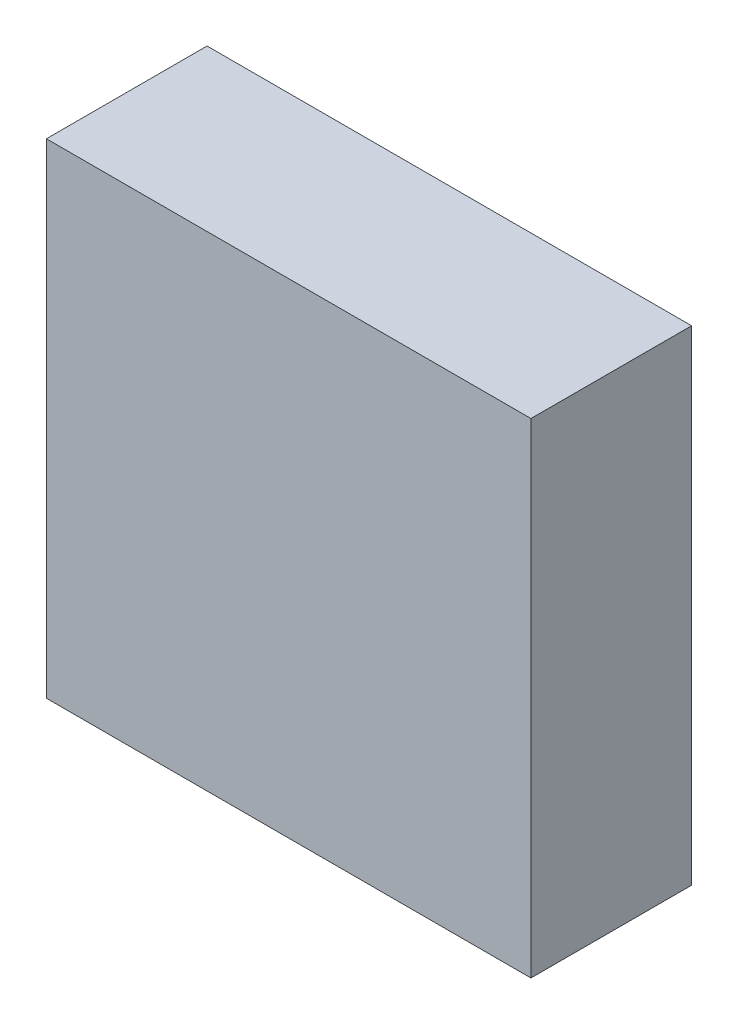
from build123d import *

# Parameters (mm, degrees)
SKETCH1_W           = 9.5
SKETCH1_H           = 9.5
BOSS_EXTRUDE1_DEPTH = 1.575


with BuildPart() as part:
    # Sketch1 → Boss-Extrude1 (new, symmetric)
    with BuildSketch(Plane.XY):
        Rectangle(SKETCH1_W, SKETCH1_H)
    extrude(amount=BOSS_EXTRUDE1_DEPTH, both=True)


solid = part.part
